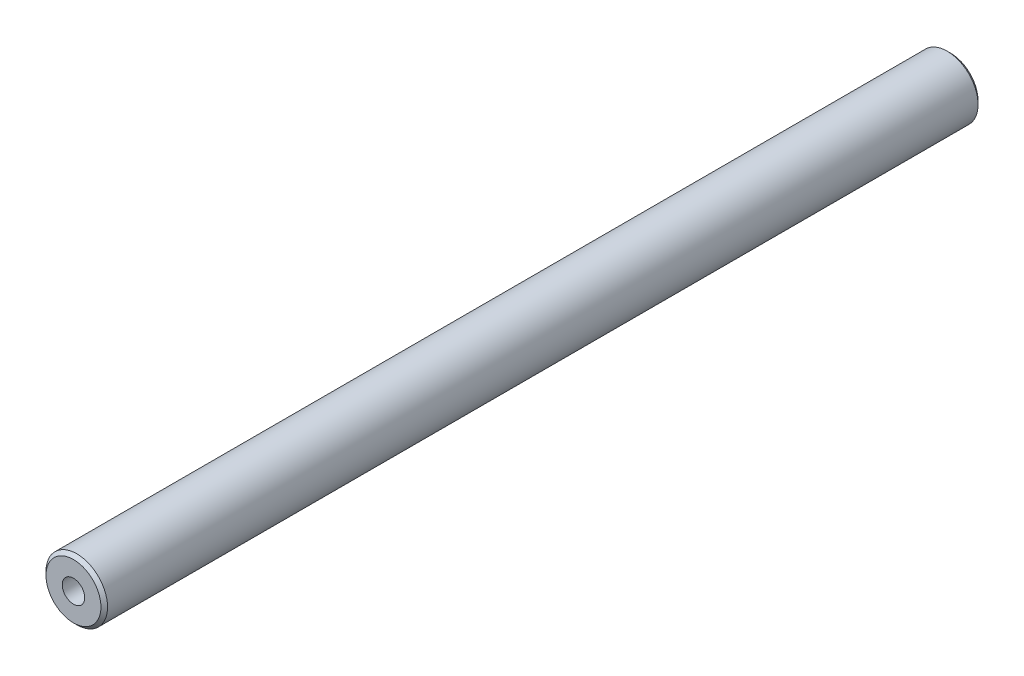
from build123d import *

# Parameters (mm, degrees)
SKETCH1_W                 = 134.82228219
SKETCH1_H                 = 4.73075
CHAMFER1_SIZE             = 0.508
F_8_32_TAPPED_HOLE1_D     = 3.4544
F_8_32_TAPPED_HOLE1_DEPTH = 10.7188
F_8_32_TAPPED_HOLE1_TIP   = 1.037806461
F_8_32_TAPPED_HOLE3_D     = 3.4544
F_8_32_TAPPED_HOLE3_DEPTH = 10.7188
F_8_32_TAPPED_HOLE3_TIP   = 1.037806461


with BuildPart() as part:
    # Sketch1 → Revolve1 (revolve)
    with BuildSketch(Plane(origin=(0, 0, 0), x_dir=(0, 0, -1), z_dir=(1, 0, 0)), mode=Mode.PRIVATE) as revolve1_sk:
        with Locations((67.411141095, 2.365375)):
            Rectangle(SKETCH1_W, SKETCH1_H)
    revolve(revolve1_sk.sketch.rotate(Axis((0, 0, 0), (0, 0, 1)), 90), axis=Axis((0, 0, 0), (0, 0, 1)))

    # Chamfer1
    chamfer1_edges = [part.edges().sort_by_distance(p)[0] for p in [
        (4.73075, 0, -134.82228219),
        (4.73075, 0, 0),
    ]]
    chamfer(chamfer1_edges, length=CHAMFER1_SIZE)

    # #8-32 Tapped Hole1
    with Locations(Plane.XY):
        with Locations((0, 0)):
            Hole(F_8_32_TAPPED_HOLE1_D / 2, depth=F_8_32_TAPPED_HOLE1_DEPTH)
            with Locations((0, 0, -(F_8_32_TAPPED_HOLE1_DEPTH + F_8_32_TAPPED_HOLE1_TIP / 2))):  # 118° drill point
                Cone(0, F_8_32_TAPPED_HOLE1_D / 2, F_8_32_TAPPED_HOLE1_TIP, mode=Mode.SUBTRACT)

    # #8-32 Tapped Hole3
    with Locations(Plane(origin=(0, 0, -134.82228219), x_dir=(-1, 0, 0), z_dir=(0, 0, -1))):
        with Locations((0, 0)):
            Hole(F_8_32_TAPPED_HOLE3_D / 2, depth=F_8_32_TAPPED_HOLE3_DEPTH)
            with Locations((0, 0, -(F_8_32_TAPPED_HOLE3_DEPTH + F_8_32_TAPPED_HOLE3_TIP / 2))):  # 118° drill point
                Cone(0, F_8_32_TAPPED_HOLE3_D / 2, F_8_32_TAPPED_HOLE3_TIP, mode=Mode.SUBTRACT)


solid = part.part
